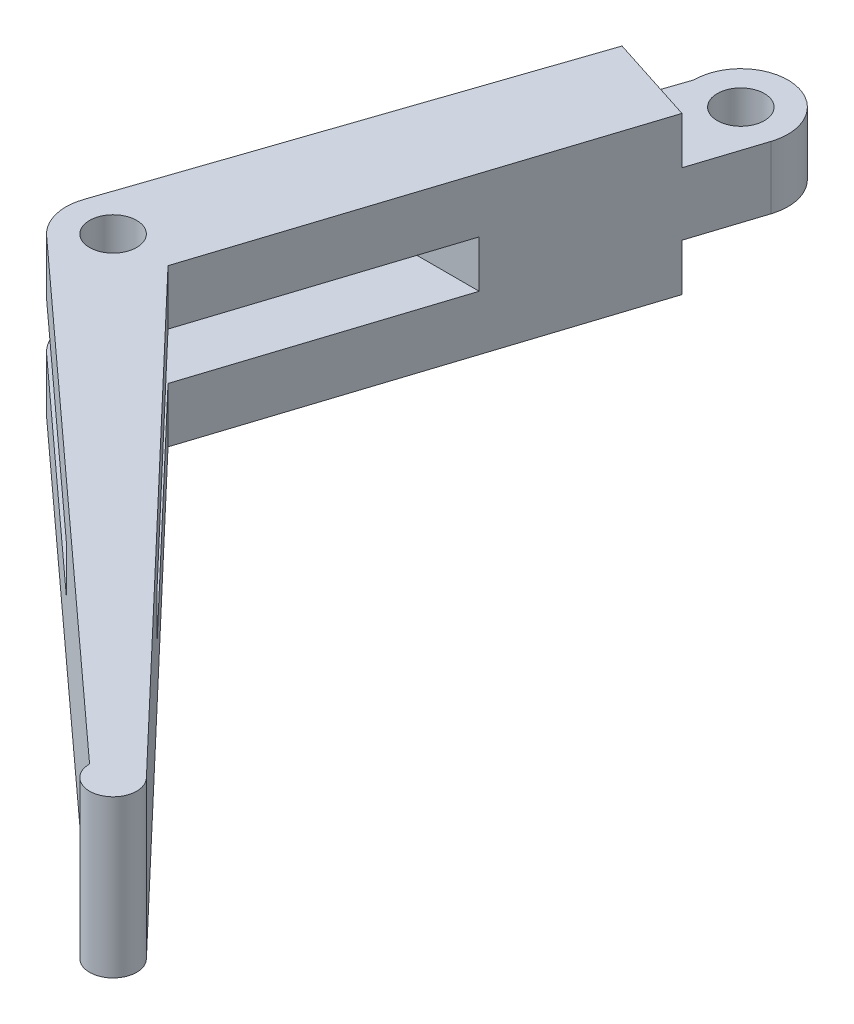
from build123d import *

# Parameters (mm, degrees)
CROQUIS1_R                 = 1.5
SALIENTE_EXTRUIR1_DEPTH    = 5
CORTAR_EXTRUIR1_DEPTH      = 45.551969752
CORTAR_EXTRUIR1_DEPTH_BACK = 45.551969752
CROQUIS2_W                 = 7.521993914
CROQUIS2_H                 = 3
CORTAR_EXTRUIR2_DEPTH      = 46.893899377
CORTAR_EXTRUIR2_DEPTH_BACK = 46.893899377
CROQUIS3_W                 = 30
CROQUIS3_H                 = 3


with BuildPart() as part:
    # Croquis1 → Saliente-Extruir1 (new, symmetric)
    with BuildSketch(Plane(origin=(0, 0, 0), x_dir=(1, 0, 0), z_dir=(0, 1, 0))):
        with BuildLine():
            Line((28.5, -30), (-2.01947172, -2.218498134))
            ThreePointArc((-2.01947172, -2.218498134), (-2.904664292, -0.750283514), (-2.84125158, 0.962958702))
            Line((-2.84125158, 0.962958702), (7, 30))
            ThreePointArc((7, 30), (10.465003416, 32.963742874), (12.855847882, 29.081232959))
            Line((12.855847882, 29.081232959), (3.5, 0))
            Line((3.5, 0), (31.086206897, -28.965517241))
            ThreePointArc((31.086206897, -28.965517241), (30.557086015, -31.392715036), (28.5, -30))
        make_face()
        with Locations(Location((10, 30, 0), (0, 0, 270))):
            Circle(CROQUIS1_R, mode=Mode.SUBTRACT)
        with Locations(Location((0, 0, 0), (0, 0, 270))):
            Circle(CROQUIS1_R, mode=Mode.SUBTRACT)
    extrude(amount=SALIENTE_EXTRUIR1_DEPTH, both=True)

    # Croquis2 → Cortar-Extruir1 (cut, two sides: drawn at the far end of the back side and taken through both)
    with BuildSketch(Plane(origin=(3.171726104, 0, 1.020389575), x_dir=(0.3062556803556079, 0, -0.9519492939489601), z_dir=(0.9519492939489601, 0, 0.3062556803556079)).offset(-CORTAR_EXTRUIR1_DEPTH_BACK)):
        with Locations((30.860038665, -3.5)):
            Rectangle(CROQUIS2_W, CROQUIS2_H)
        with Locations((30.860038665, 3.5)):
            Rectangle(CROQUIS2_W, CROQUIS2_H)
    extrude(amount=CORTAR_EXTRUIR1_DEPTH + CORTAR_EXTRUIR1_DEPTH_BACK, mode=Mode.SUBTRACT)

    # Croquis3 → Cortar-Extruir2 (cut, two sides: drawn at the far end of the back side and taken through both)
    with BuildSketch(Plane(origin=(0, 0, 0), x_dir=(0, 0, -1), z_dir=(1, 0, 0)).offset(-CORTAR_EXTRUIR2_DEPTH_BACK)):
        Rectangle(CROQUIS3_W, CROQUIS3_H)
    extrude(amount=CORTAR_EXTRUIR2_DEPTH + CORTAR_EXTRUIR2_DEPTH_BACK, mode=Mode.SUBTRACT)


solid = part.part
